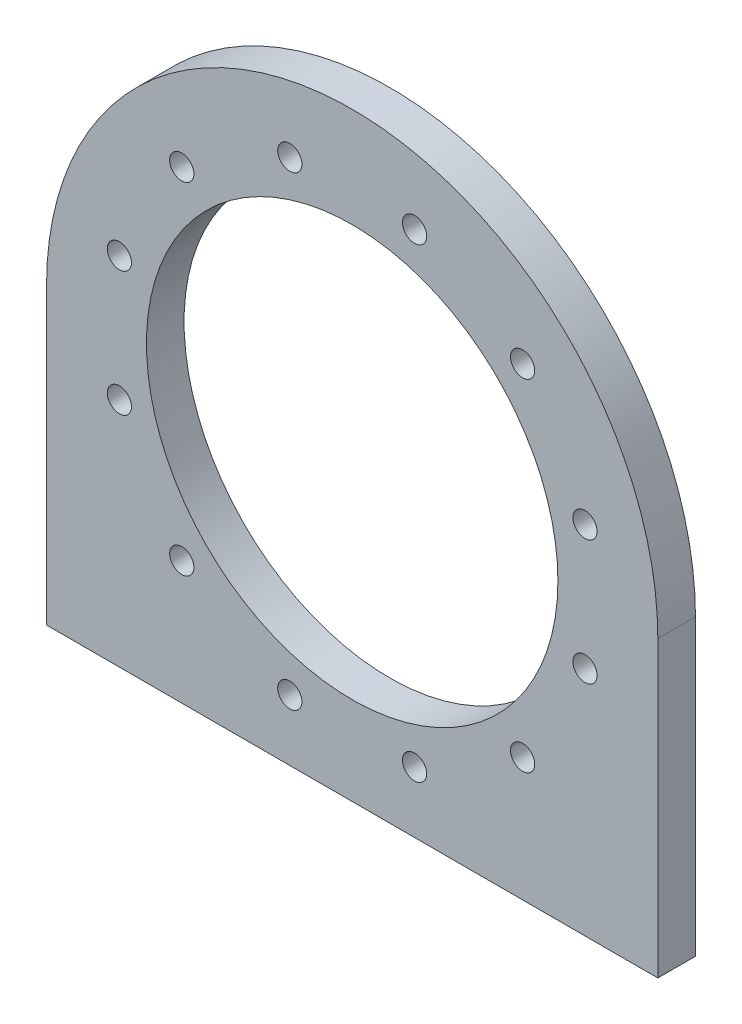
from build123d import *

# Parameters (mm, degrees)
SKETCH_1_R          = 87.5
EXTRUDE_1_DEPTH     = 16
CUT_EXTRUDE_1_REACH = 186.543
SKETCH_2_R          = 5.15


with BuildPart() as part:
    # 草图1 → 凸台-拉伸1 (new body)
    with BuildSketch(Plane.XY):
        with BuildLine():
            Line((-130, 0), (-130, -125))
            Line((-130, -125), (130, -125))
            Line((130, -125), (130, 0))
            ThreePointArc((130, 0), (0, 130), (-130, 0))
        make_face()
        Circle(SKETCH_1_R, mode=Mode.SUBTRACT)
    extrude(amount=EXTRUDE_1_DEPTH)

    # 草图2 → 切除-拉伸1 (cut, up to next)
    with BuildSketch(Plane.XY.offset(16), mode=Mode.PRIVATE) as cut_extrude_1_sk1:
        with Locations((-26.528952123, 99.007397195)):
            Circle(SKETCH_2_R)
    cut_extrude_1_tool1 = extrude(cut_extrude_1_sk1.sketch, amount=-CUT_EXTRUDE_1_REACH, mode=Mode.PRIVATE) & part.part
    # 草图2 → 切除-拉伸1 (cut, up to next)
    with BuildSketch(Plane.XY.offset(16), mode=Mode.PRIVATE) as cut_extrude_1_sk2:
        with Locations((26.528952123, 99.007397195)):
            Circle(SKETCH_2_R)
    cut_extrude_1_tool2 = extrude(cut_extrude_1_sk2.sketch, amount=-CUT_EXTRUDE_1_REACH, mode=Mode.PRIVATE) & part.part
    # 草图2 → 切除-拉伸1 (cut, up to next)
    with BuildSketch(Plane.XY.offset(16), mode=Mode.PRIVATE) as cut_extrude_1_sk3:
        with Locations((72.478445072, 72.478445072)):
            Circle(SKETCH_2_R)
    cut_extrude_1_tool3 = extrude(cut_extrude_1_sk3.sketch, amount=-CUT_EXTRUDE_1_REACH, mode=Mode.PRIVATE) & part.part
    # 草图2 → 切除-拉伸1 (cut, up to next)
    with BuildSketch(Plane.XY.offset(16), mode=Mode.PRIVATE) as cut_extrude_1_sk4:
        with Locations((99.007397195, 26.528952123)):
            Circle(SKETCH_2_R)
    cut_extrude_1_tool4 = extrude(cut_extrude_1_sk4.sketch, amount=-CUT_EXTRUDE_1_REACH, mode=Mode.PRIVATE) & part.part
    # 草图2 → 切除-拉伸1 (cut, up to next)
    with BuildSketch(Plane.XY.offset(16), mode=Mode.PRIVATE) as cut_extrude_1_sk5:
        with Locations((99.007397195, -26.528952123)):
            Circle(SKETCH_2_R)
    cut_extrude_1_tool5 = extrude(cut_extrude_1_sk5.sketch, amount=-CUT_EXTRUDE_1_REACH, mode=Mode.PRIVATE) & part.part
    # 草图2 → 切除-拉伸1 (cut, up to next)
    with BuildSketch(Plane.XY.offset(16), mode=Mode.PRIVATE) as cut_extrude_1_sk6:
        with Locations((72.478445072, -72.478445072)):
            Circle(SKETCH_2_R)
    cut_extrude_1_tool6 = extrude(cut_extrude_1_sk6.sketch, amount=-CUT_EXTRUDE_1_REACH, mode=Mode.PRIVATE) & part.part
    # 草图2 → 切除-拉伸1 (cut, up to next)
    with BuildSketch(Plane.XY.offset(16), mode=Mode.PRIVATE) as cut_extrude_1_sk7:
        with Locations((26.528952123, -99.007397195)):
            Circle(SKETCH_2_R)
    cut_extrude_1_tool7 = extrude(cut_extrude_1_sk7.sketch, amount=-CUT_EXTRUDE_1_REACH, mode=Mode.PRIVATE) & part.part
    # 草图2 → 切除-拉伸1 (cut, up to next)
    with BuildSketch(Plane.XY.offset(16), mode=Mode.PRIVATE) as cut_extrude_1_sk8:
        with Locations((-26.528952123, -99.007397195)):
            Circle(SKETCH_2_R)
    cut_extrude_1_tool8 = extrude(cut_extrude_1_sk8.sketch, amount=-CUT_EXTRUDE_1_REACH, mode=Mode.PRIVATE) & part.part
    # 草图2 → 切除-拉伸1 (cut, up to next)
    with BuildSketch(Plane.XY.offset(16), mode=Mode.PRIVATE) as cut_extrude_1_sk9:
        with Locations((-72.478445072, -72.478445072)):
            Circle(SKETCH_2_R)
    cut_extrude_1_tool9 = extrude(cut_extrude_1_sk9.sketch, amount=-CUT_EXTRUDE_1_REACH, mode=Mode.PRIVATE) & part.part
    # 草图2 → 切除-拉伸1 (cut, up to next)
    with BuildSketch(Plane.XY.offset(16), mode=Mode.PRIVATE) as cut_extrude_1_sk10:
        with Locations((-99.007397195, -26.528952123)):
            Circle(SKETCH_2_R)
    cut_extrude_1_tool10 = extrude(cut_extrude_1_sk10.sketch, amount=-CUT_EXTRUDE_1_REACH, mode=Mode.PRIVATE) & part.part
    # 草图2 → 切除-拉伸1 (cut, up to next)
    with BuildSketch(Plane.XY.offset(16), mode=Mode.PRIVATE) as cut_extrude_1_sk11:
        with Locations((-99.007397195, 26.528952123)):
            Circle(SKETCH_2_R)
    cut_extrude_1_tool11 = extrude(cut_extrude_1_sk11.sketch, amount=-CUT_EXTRUDE_1_REACH, mode=Mode.PRIVATE) & part.part
    # 草图2 → 切除-拉伸1 (cut, up to next)
    with BuildSketch(Plane.XY.offset(16), mode=Mode.PRIVATE) as cut_extrude_1_sk12:
        with Locations((-72.478445072, 72.478445072)):
            Circle(SKETCH_2_R)
    cut_extrude_1_tool12 = extrude(cut_extrude_1_sk12.sketch, amount=-CUT_EXTRUDE_1_REACH, mode=Mode.PRIVATE) & part.part
    add(cut_extrude_1_tool1.solids().sort_by_distance((-26.528952, 99.007397, 16))[0], mode=Mode.SUBTRACT)
    add(cut_extrude_1_tool2.solids().sort_by_distance((26.528952, 99.007397, 16))[0], mode=Mode.SUBTRACT)
    add(cut_extrude_1_tool3.solids().sort_by_distance((72.478445, 72.478445, 16))[0], mode=Mode.SUBTRACT)
    add(cut_extrude_1_tool4.solids().sort_by_distance((99.007397, 26.528952, 16))[0], mode=Mode.SUBTRACT)
    add(cut_extrude_1_tool5.solids().sort_by_distance((99.007397, -26.528952, 16))[0], mode=Mode.SUBTRACT)
    add(cut_extrude_1_tool6.solids().sort_by_distance((72.478445, -72.478445, 16))[0], mode=Mode.SUBTRACT)
    add(cut_extrude_1_tool7.solids().sort_by_distance((26.528952, -99.007397, 16))[0], mode=Mode.SUBTRACT)
    add(cut_extrude_1_tool8.solids().sort_by_distance((-26.528952, -99.007397, 16))[0], mode=Mode.SUBTRACT)
    add(cut_extrude_1_tool9.solids().sort_by_distance((-72.478445, -72.478445, 16))[0], mode=Mode.SUBTRACT)
    add(cut_extrude_1_tool10.solids().sort_by_distance((-99.007397, -26.528952, 16))[0], mode=Mode.SUBTRACT)
    add(cut_extrude_1_tool11.solids().sort_by_distance((-99.007397, 26.528952, 16))[0], mode=Mode.SUBTRACT)
    add(cut_extrude_1_tool12.solids().sort_by_distance((-72.478445, 72.478445, 16))[0], mode=Mode.SUBTRACT)


solid = part.part
